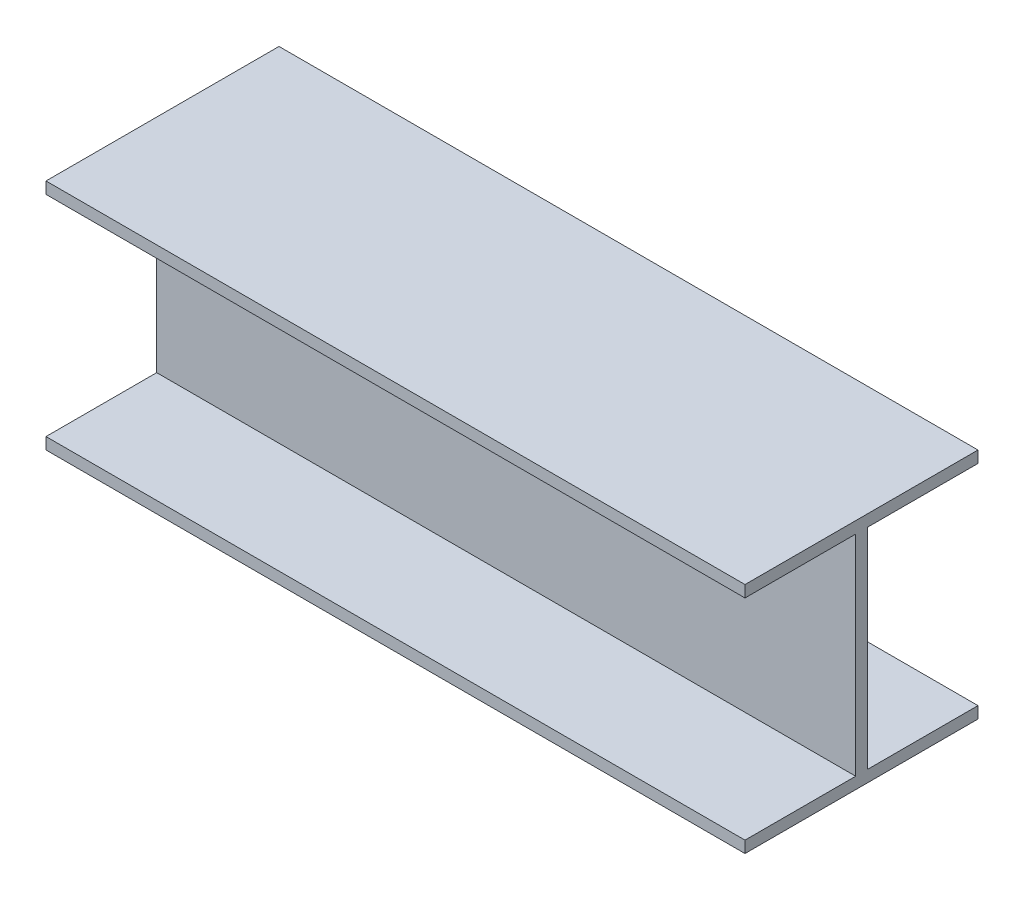
from build123d import *

# Parameters (mm, degrees)
BOSS_EXTRUDE1_DEPTH = 600


with BuildPart() as part:
    # Sketch1 → Boss-Extrude1 (new body)
    with BuildSketch(Plane(origin=(0, 0, 0), x_dir=(0, 0, -1), z_dir=(1, 0, 0))):
        Polygon((100, 100), (-100, 100), (-100, 90), (-5, 90), (-5, -90), (-100, -90), (-100, -100), (100, -100), (100, -90), (5, -90), (5, 90), (100, 90), align=None)
    extrude(amount=BOSS_EXTRUDE1_DEPTH)


solid = part.part
